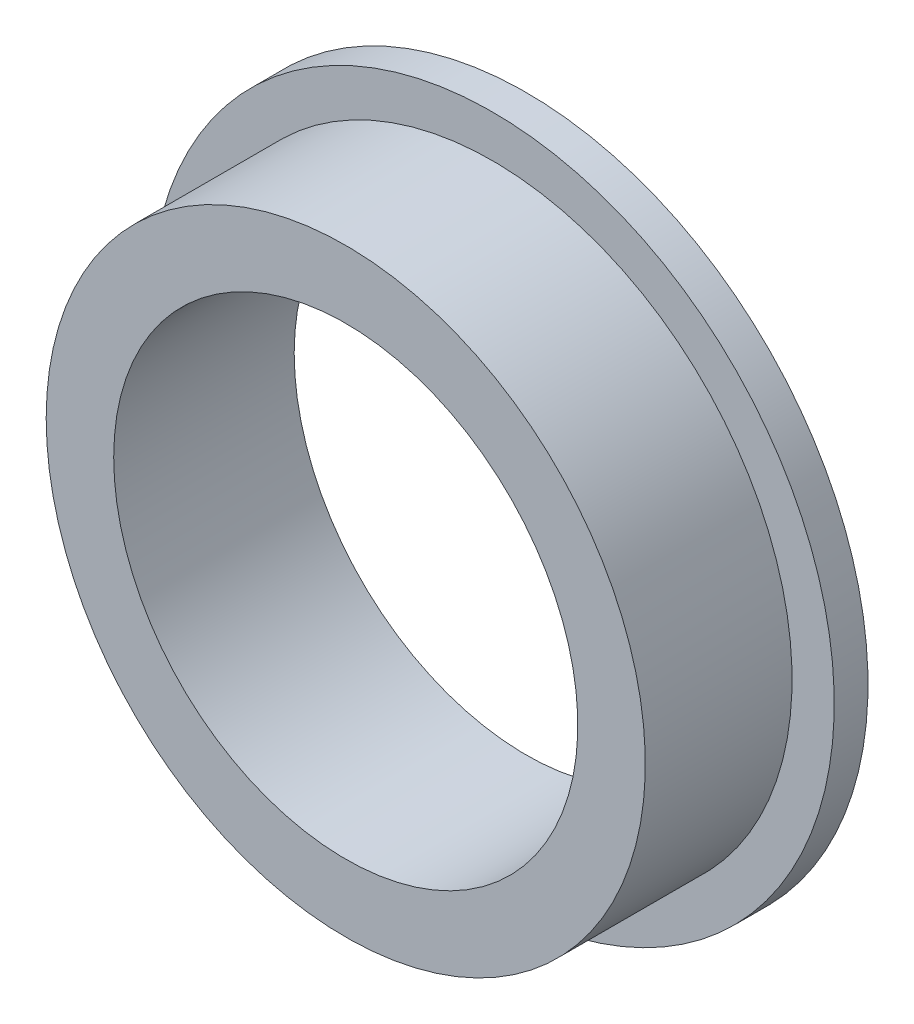
from build123d import *


with BuildPart() as part:
    # Sketch1 → Revolve1 (revolve)
    with BuildSketch(Plane(origin=(0, 0, 0), x_dir=(1, 0, 0), z_dir=(0, 1, 0))):
        Polygon((-27.5, 30.623559799), (-27.5, 13.235461059), (-35.5, 13.235461059), (-35.5, 30.623559799), (-40.5, 30.623559799), (-40.5, 34.623559799), (-27.5, 34.623559799), align=None)
    revolve(axis=Axis((0, 0, -62.842683934), (0, 0, 1)))


solid = part.part
